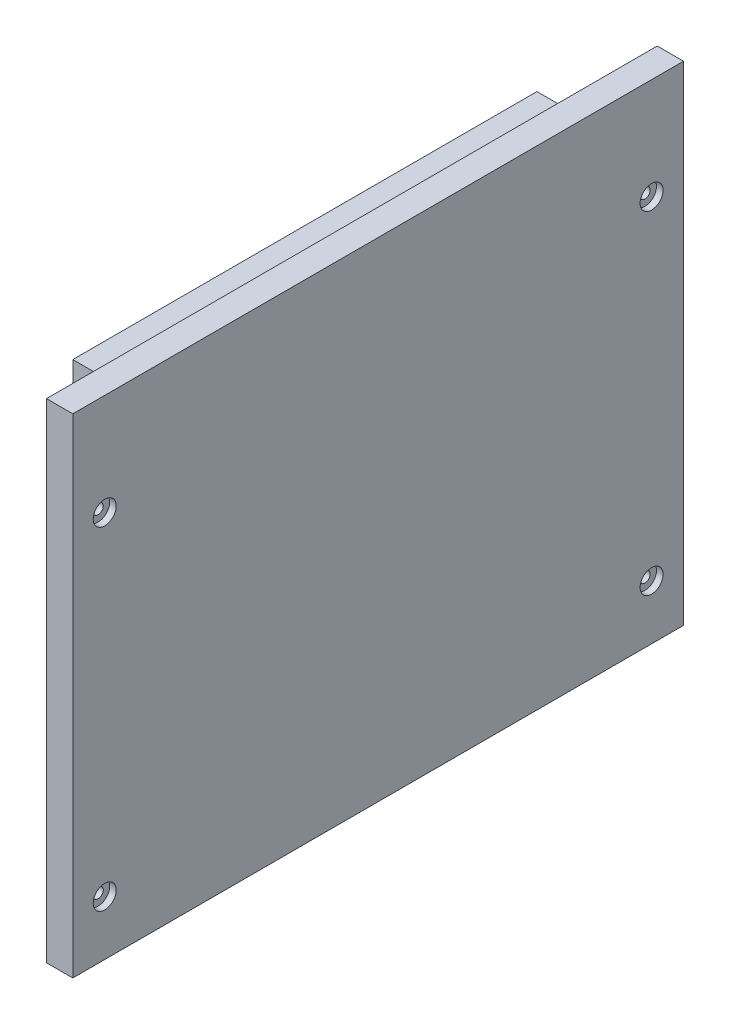
from build123d import *

# Parameters (mm, degrees)
SKETCH1_W                               = 325
SKETCH1_H                               = 260
BOSS_EXTRUDE1_DEPTH                     = 39
CBORE_FOR_M5_HEX_HEAD_BOLT1_D           = 5.5
CBORE_FOR_M5_HEX_HEAD_BOLT1_DEPTH       = 30
CBORE_FOR_M5_HEX_HEAD_BOLT1_CBORE_D     = 12.238
CBORE_FOR_M5_HEX_HEAD_BOLT1_CBORE_DEPTH = 3.5
CBORE_FOR_M5_HEX_HEAD_BOLT1_TIP         = 1.652366702
SKETCH10_W                              = 39
SKETCH10_H                              = 260
CUT_EXTRUDE2_DEPTH                      = 25
SKETCH11_W                              = 25
SKETCH11_H                              = 247
CUT_EXTRUDE3_DEPTH                      = 14
F_6_0MM_DOWEL_HOLE1_D                   = 6
F_6_0MM_DOWEL_HOLE1_DEPTH               = 15
F_6_0MM_DOWEL_HOLE1_TIP                 = 1.802581857
CUT_EXTRUDE4_DEPTH                      = 222.463315247
CUT_EXTRUDE4_DEPTH_BACK                 = 222.463315247
SKETCH15_W                              = 25
SKETCH15_H                              = 14


with BuildPart() as part:
    # Sketch1 → Boss-Extrude1 (new body)
    with BuildSketch(Plane(origin=(0, 0, 0), x_dir=(0, 0, -1), z_dir=(1, 0, 0))):
        with Locations((-12.5, 0)):
            Rectangle(SKETCH1_W, SKETCH1_H)
    extrude(amount=BOSS_EXTRUDE1_DEPTH)

    # CBORE for M5 Hex Head Bolt1
    with Locations(Plane(origin=(39, 0, 0), x_dir=(0, 0, -1), z_dir=(1, 0, 0))):
        with Locations((133, -101), (133, 76), (-158, 76), (-158, -101)):
            CounterBoreHole(CBORE_FOR_M5_HEX_HEAD_BOLT1_D / 2, CBORE_FOR_M5_HEX_HEAD_BOLT1_CBORE_D / 2, CBORE_FOR_M5_HEX_HEAD_BOLT1_CBORE_DEPTH, depth=CBORE_FOR_M5_HEX_HEAD_BOLT1_DEPTH)
            with Locations((0, 0, -(CBORE_FOR_M5_HEX_HEAD_BOLT1_DEPTH + CBORE_FOR_M5_HEX_HEAD_BOLT1_TIP / 2))):  # 118° drill point
                Cone(0, CBORE_FOR_M5_HEX_HEAD_BOLT1_D / 2, CBORE_FOR_M5_HEX_HEAD_BOLT1_TIP, mode=Mode.SUBTRACT)

    # Sketch10 → Cut-Extrude2 (cut)
    with BuildSketch(Plane(origin=(0, 0, 0), x_dir=(0, 0, -1), z_dir=(1, 0, 0))):
        with Locations((130.5, 0)):
            Rectangle(SKETCH10_W, SKETCH10_H)
        with Locations((-155.5, 0)):
            Rectangle(SKETCH10_W, SKETCH10_H)
    extrude(amount=CUT_EXTRUDE2_DEPTH, mode=Mode.SUBTRACT)

    # Sketch11 → Cut-Extrude3 (cut)
    with BuildSketch(Plane(origin=(0, 130, 0), x_dir=(1, 0, 0), z_dir=(0, 1, 0))):
        with Locations((12.5, -12.5)):
            Rectangle(SKETCH11_W, SKETCH11_H)
    extrude(amount=-CUT_EXTRUDE3_DEPTH, mode=Mode.SUBTRACT)

    # Ø6.0mm Dowel Hole1
    with Locations(Plane(origin=(0, 116, 0), x_dir=(1, 0, 0), z_dir=(0, 1, 0))):
        with Locations((14, 71.5), (14, -96.5)):
            Hole(F_6_0MM_DOWEL_HOLE1_D / 2, depth=F_6_0MM_DOWEL_HOLE1_DEPTH)
            with Locations((0, 0, -(F_6_0MM_DOWEL_HOLE1_DEPTH + F_6_0MM_DOWEL_HOLE1_TIP / 2))):  # 118° drill point
                Cone(0, F_6_0MM_DOWEL_HOLE1_D / 2, F_6_0MM_DOWEL_HOLE1_TIP, mode=Mode.SUBTRACT)

    # Sketch15 → Cut-Extrude4 (cut, two sides: drawn at the far end of the back side and taken through both)
    with BuildSketch(Plane.XY.offset(-CUT_EXTRUDE4_DEPTH_BACK)):
        with Locations((12.5, -123)):
            Rectangle(SKETCH15_W, SKETCH15_H)
    extrude(amount=CUT_EXTRUDE4_DEPTH + CUT_EXTRUDE4_DEPTH_BACK, mode=Mode.SUBTRACT)


solid = part.part
